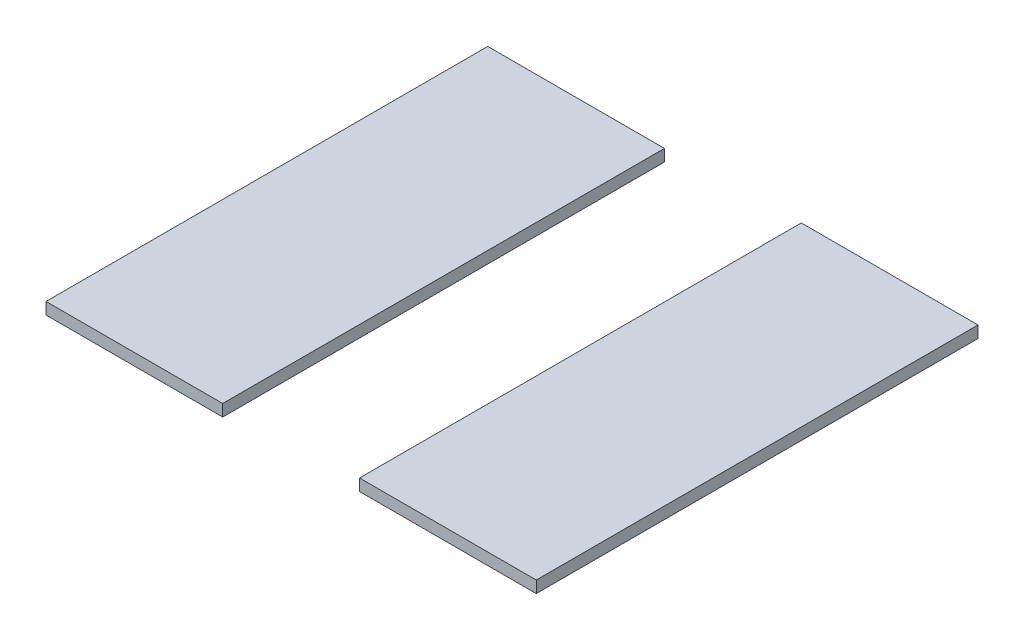
from build123d import *

# Parameters (mm, degrees)
SKETCH1_W   = 76.2
SKETCH1_H   = 190.5
THICKEN1_T1 = 5.08
SKETCH2_W   = 76.2
SKETCH2_H   = 190.5
THICKEN2_T1 = 5.08


with BuildPart() as body_1:
    # Sketch1 → Surface-Plane1: a flat surface bounded by the sketch
    with BuildSketch(Plane(origin=(0, 0, 0), x_dir=(1, 0, 0), z_dir=(0, 1, 0)), mode=Mode.PRIVATE) as surface_plane1_1_region:
        with Locations((-121.35322314, 1.920743802)):
            Rectangle(SKETCH1_W, SKETCH1_H)
    surface_plane1_1 = surface_plane1_1_region.sketch.faces()[0]
    add(Solid.thicken(surface_plane1_1, THICKEN1_T1))


with BuildPart() as body_2:
    # Sketch2 → Surface-Plane2: a flat surface bounded by the sketch
    with BuildSketch(Plane(origin=(0, 0, 0), x_dir=(1, 0, 0), z_dir=(0, 1, 0)), mode=Mode.PRIVATE) as surface_plane2_2_region:
        with Locations((-254.891531356, 0.238317939)):
            Rectangle(SKETCH2_W, SKETCH2_H)
    surface_plane2_2 = surface_plane2_2_region.sketch.faces()[0]
    add(Solid.thicken(surface_plane2_2, THICKEN2_T1))


solid = Compound([body_1.part, body_2.part])
